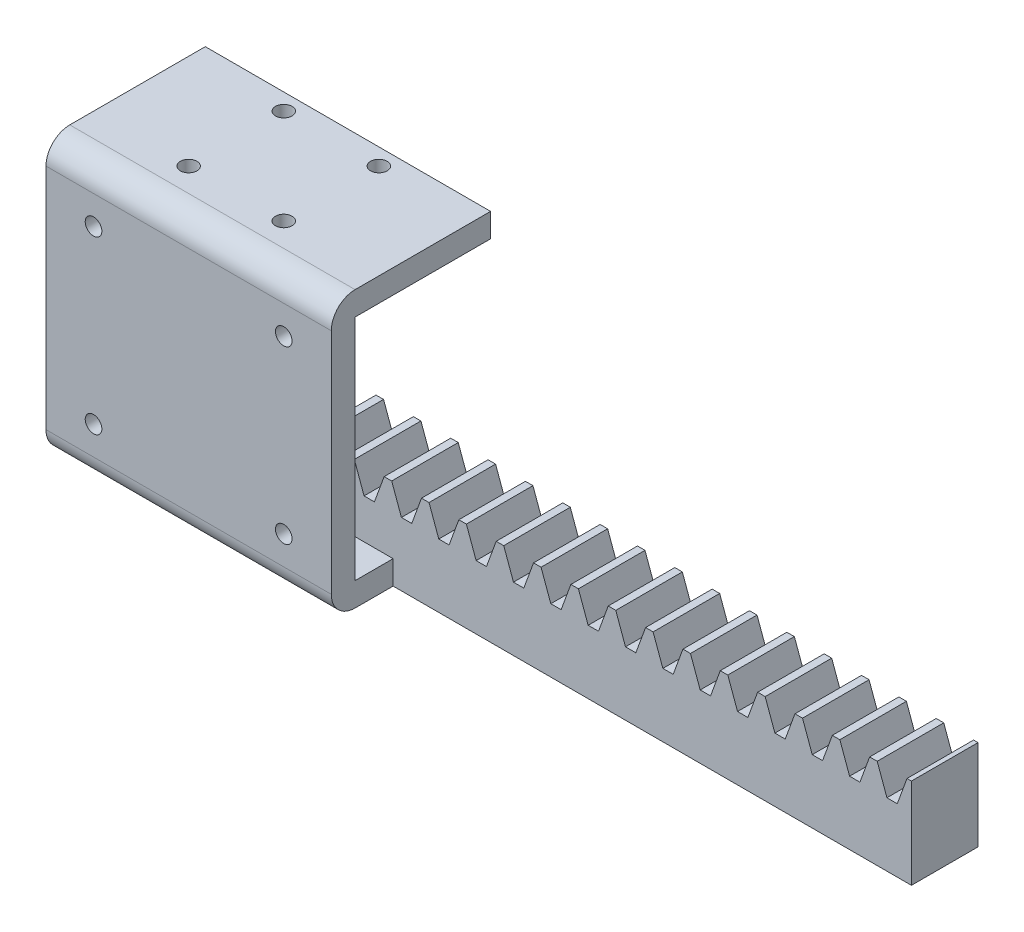
from build123d import *

# Parameters (mm, degrees)
BLANKSKE_W              = 209
BLANKSKE_H              = 12.5
BLANK_DEPTH             = 14
TOOTHCUTILL_DEPTH       = 210.841011244
TOOTHCUTSIM_DEPTH       = 210.841011244
TEETHCUTS_COUNT         = 27
TEETHCUTS_PITCH         = 7.853981625
SKETCH8_W               = 209
SKETCH8_H               = 14
BOSS_EXTRUDE3_DEPTH     = 6.5
BOSS_EXTRUDE1_START     = -209
BOSS_EXTRUDE1_DEPTH     = 60
SKETCH4_R               = 1.75
CUT_EXTRUDE1_DEPTH      = 5
BOSS_EXTRUDE2_REACH     = 218.588
SKETCH6_W               = 26
SKETCH6_H               = 8
CUT_EXTRUDE2_DEPTH      = 214.593656273
CUT_EXTRUDE2_DEPTH_BACK = 214.593656273
SKETCH7_R               = 1.75
FILLET1_R               = 5
SKETCH9_W               = 14
SKETCH9_H               = 19
CUT_EXTRUDE3_DEPTH      = 40


with BuildPart() as part:
    # BlankSke → Blank (new body)
    with BuildSketch(Plane.XY):
        with Locations((104.5, 6.25)):
            Rectangle(BLANKSKE_W, BLANKSKE_H)
    extrude(amount=-BLANK_DEPTH)

    # TooCutSkeIll → ToothCutIll (cut, through all)
    with BuildSketch(Plane.XY):
        with BuildLine():
            Line((-3.110472484, 12.434202014), (-1.237006086, 7.28689539))
            ThreePointArc((-1.237006086, 7.28689539), (-1.007817354, 6.98821082), (-0.648758505, 6.875))
            Line((-0.648758505, 6.875), (0.648758505, 6.875))
            ThreePointArc((0.648758505, 6.875), (1.007817354, 6.98821082), (1.237006086, 7.28689539))
            Line((1.237006086, 7.28689539), (3.110472484, 12.434202014))
            ThreePointArc((3.110472484, 12.434202014), (3.147084102, 12.481915204), (3.204441746, 12.5))
            Line((3.204441746, 12.5), (3.204441746, 12.5254))
            Line((3.204441746, 12.5254), (-3.204441746, 12.5254))
            Line((-3.204441746, 12.5254), (-3.204441746, 12.5))
            ThreePointArc((-3.204441746, 12.5), (-3.147084102, 12.481915204), (-3.110472484, 12.434202014))
        make_face()
    extrude(amount=-TOOTHCUTILL_DEPTH, mode=Mode.SUBTRACT)

    # TooCutSkeSim → ToothCutSim (cut, through all)
    with BuildSketch(Plane.XY):
        Polygon((1.087088424, 6.875), (-1.087088424, 6.875), (-3.143665836, 12.5254), (3.143665836, 12.5254), align=None)
    toothcutsim = extrude(amount=-TOOTHCUTSIM_DEPTH, mode=Mode.SUBTRACT)

    # TeethCuts: ToothCutSim ×27
    with Locations(*[(i * TEETHCUTS_PITCH, 0, 0) for i in range(1, TEETHCUTS_COUNT)]):
        add(toothcutsim, mode=Mode.SUBTRACT)

    # Sketch8 → Boss-Extrude3 (add)
    with BuildSketch(Plane.XZ):
        with Locations((104.5, -7)):
            Rectangle(SKETCH8_W, SKETCH8_H)
    extrude(amount=BOSS_EXTRUDE3_DEPTH)

    # Sketch3 → Boss-Extrude1 (add)
    with BuildSketch(Plane(origin=(209, 0, 0), x_dir=(0, 0, -1), z_dir=(1, 0, 0)).offset(BOSS_EXTRUDE1_START)):
        Polygon((20.5, -6.5), (-13, -6.5), (-13, 51.5), (20.5, 51.5), (20.5, 46.5), (-8, 46.5), (-8, -1.5), (20.5, -1.5), align=None)
    extrude(amount=BOSS_EXTRUDE1_DEPTH)

    # Sketch4 → Cut-Extrude1 (cut)
    with BuildSketch(Plane.XY.offset(13)):
        with Locations((10, 40.5)):
            Circle(SKETCH4_R)
        with Locations((50, 40.5)):
            Circle(SKETCH4_R)
        with Locations((50, 4.5)):
            Circle(SKETCH4_R)
        with Locations((10, 4.5)):
            Circle(SKETCH4_R)
    extrude(amount=-CUT_EXTRUDE1_DEPTH, mode=Mode.SUBTRACT)

    # Boss-Extrude2: up to this face of the body (flat: up to its plane)
    boss_extrude2_end = Plane(part.part.faces().sort_by_distance((19.634954063, 12.5, -7))[0])
    # Sketch6 → Boss-Extrude2 (add, up to the picked face)
    with BuildSketch(Plane(origin=(0, -1.5, 0), x_dir=(1, 0, 0), z_dir=(0, 1, 0)), mode=Mode.PRIVATE) as boss_extrude2_sk1:
        with Locations((30, -4)):
            Rectangle(SKETCH6_W, SKETCH6_H)
    boss_extrude2_tool1 = split(extrude(boss_extrude2_sk1.sketch, amount=BOSS_EXTRUDE2_REACH, mode=Mode.PRIVATE), bisect_by=boss_extrude2_end, keep=Keep.BOTH, mode=Mode.PRIVATE)
    add(boss_extrude2_tool1.solids().sort_by(Axis((30, -1.5, 4), (0, 1, 0)))[0])

    # Sketch7 → Cut-Extrude2 (cut, two sides: drawn at the far end of the back side and taken through both)
    with BuildSketch(Plane(origin=(0, 12.5, 0), x_dir=(1, 0, 0), z_dir=(0, 1, 0)).offset(-CUT_EXTRUDE2_DEPTH_BACK)):
        with Locations(Location((20, 17, 0), (0, 0, 270))):
            Circle(SKETCH7_R)
        with Locations(Location((40, 17, 0), (0, 0, 270))):
            Circle(SKETCH7_R)
        with Locations(Location((40, -3, 0), (0, 0, 270))):
            Circle(SKETCH7_R)
        with Locations(Location((20, -3, 0), (0, 0, 270))):
            Circle(SKETCH7_R)
    extrude(amount=CUT_EXTRUDE2_DEPTH + CUT_EXTRUDE2_DEPTH_BACK, mode=Mode.SUBTRACT)

    # Fillet1
    fillet1_edges = [part.edges().sort_by_distance(p)[0] for p in [
        (30, -6.5, 13),
        (30, 51.5, 13),
    ]]
    fillet(fillet1_edges, radius=FILLET1_R)

    # Sketch9 → Cut-Extrude3 (cut)
    with BuildSketch(Plane(origin=(209, 0, 0), x_dir=(0, 0, -1), z_dir=(1, 0, 0))):
        with Locations((7, 3)):
            Rectangle(SKETCH9_W, SKETCH9_H)
    extrude(amount=-CUT_EXTRUDE3_DEPTH, mode=Mode.SUBTRACT)


solid = part.part
